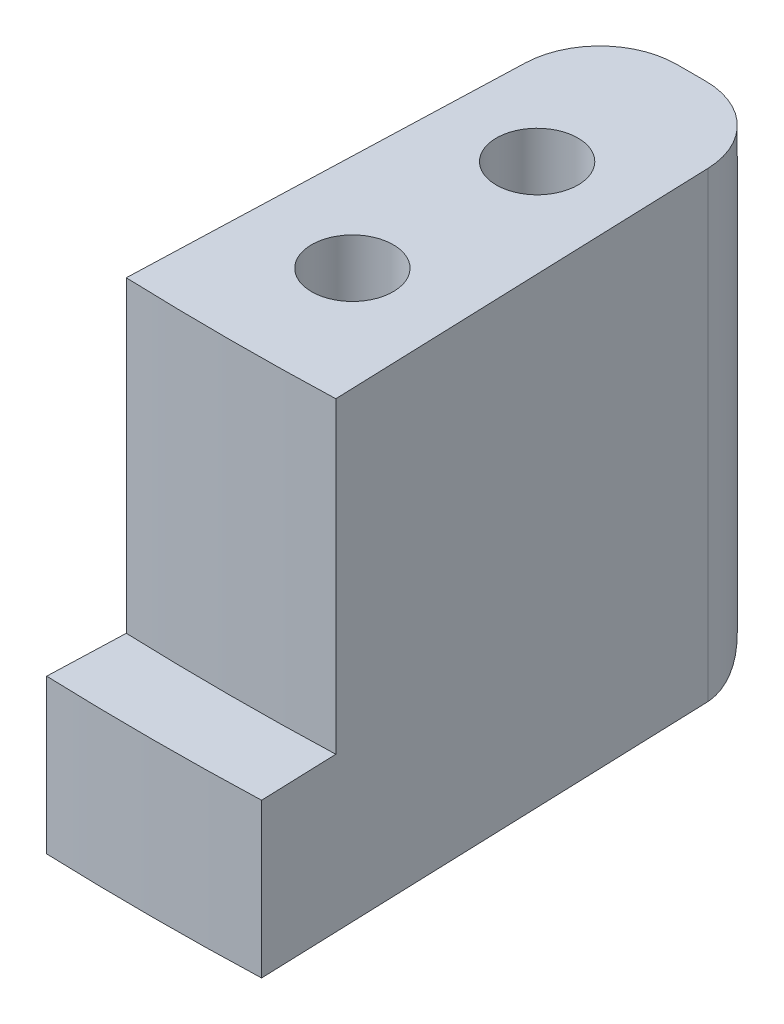
from build123d import *

# Parameters (mm, degrees)
EXTRUDE_583_DEPTH   = 30
EXTRUDE_631_DEPTH   = 10
FILLET_1_R          = 5
HOLE_WIZARD_M5_1_D  = 5.3
CUT_EXTRUDE_1_DEPTH = 5


with BuildPart() as part:
    # 草图1 → Extrude 583 (new body)
    with BuildSketch(Plane(origin=(0, 0, 0), x_dir=(1, 0, 0), z_dir=(0, 1, 0))):
        with BuildLine():
            Line((5.761926966, -165), (-5.761926966, -165))
            Line((-5.761926966, -165), (-6.805401857, -194.881211269))
            ThreePointArc((-6.805401857, -194.881211269), (0, -195), (6.805401857, -194.881211269))
            Line((6.805401857, -194.881211269), (5.761926966, -165))
        make_face()
    extrude(amount=EXTRUDE_583_DEPTH)

    # 草图1<3> → Extrude 631 (add)
    with BuildSketch(Plane(origin=(0, 0, 0), x_dir=(1, 0, 0), z_dir=(0, 1, 0))):
        with BuildLine():
            ThreePointArc((6.805401857, -194.881211269), (0, -195), (-6.805401857, -194.881211269))
            Line((-6.805401857, -194.881211269), (-6.979899341, -199.878165404))
            ThreePointArc((-6.979899341, -199.878165404), (0, -200), (6.979899341, -199.878165404))
            Line((6.979899341, -199.878165404), (6.805401857, -194.881211269))
        make_face()
    extrude(amount=EXTRUDE_631_DEPTH)

    # 圆角1
    fillet_1_edges = [part.edges().sort_by_distance(p)[0] for p in [
        (0, 0, 165),
        (-5.761926966, 15, 165),
        (5.761926966, 15, 165),
    ]]
    fillet(fillet_1_edges, radius=FILLET_1_R)

    # M5 间隙孔1 (through all)
    with Locations(Plane(origin=(0, 30, 0), x_dir=(1, 0, 0), z_dir=(0, 1, 0))):
        with Locations((0, -187), (0, -175)):
            Hole(HOLE_WIZARD_M5_1_D / 2)

    # 草图6 → 切除-拉伸1 (cut)
    with BuildSketch(Plane.XZ):
        Polygon((-4.67653718, 175), (-2.33826859, 170.95), (2.33826859, 170.95), (4.67653718, 175), (2.33826859, 179.05), (-2.33826859, 179.05), align=None)
        Polygon((-4.67653718, 187), (-2.33826859, 182.95), (2.33826859, 182.95), (4.67653718, 187), (2.33826859, 191.05), (-2.33826859, 191.05), align=None)
    extrude(amount=-CUT_EXTRUDE_1_DEPTH, mode=Mode.SUBTRACT)


solid = part.part
